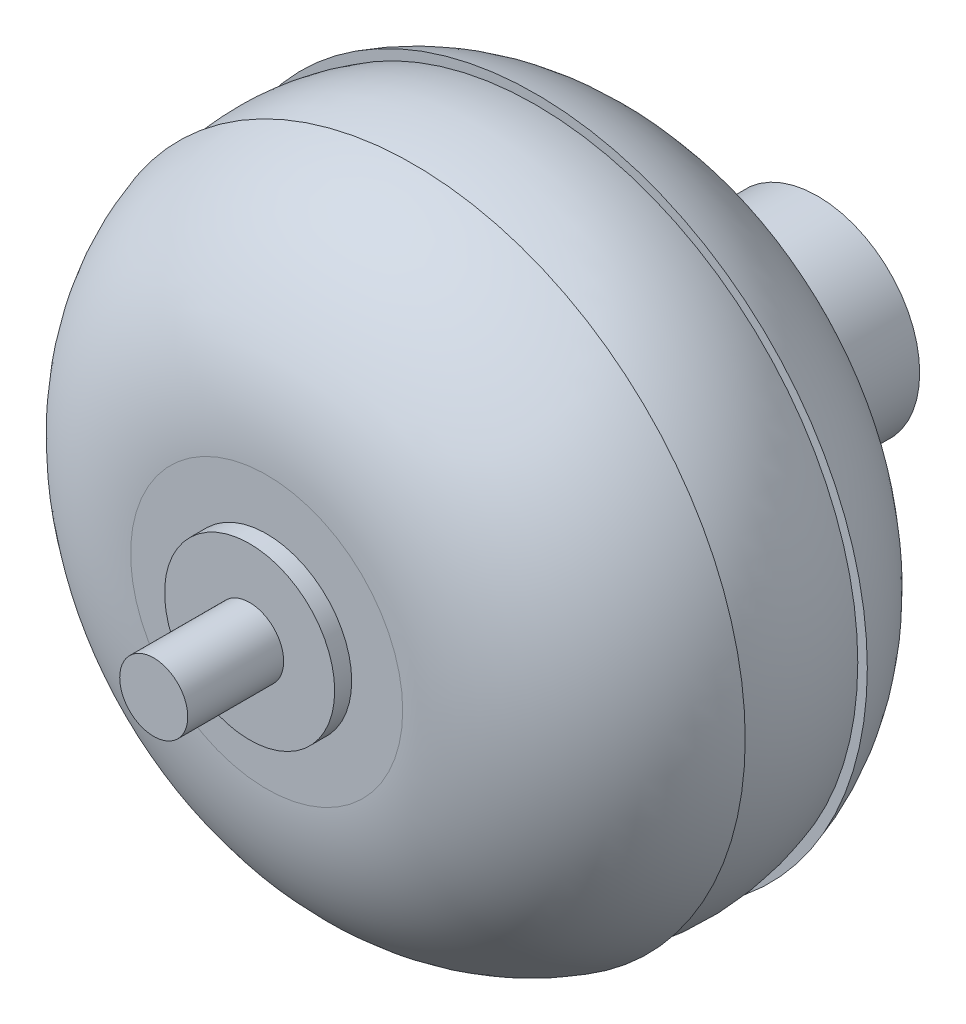
from build123d import *

# Parameters (mm, degrees)
SKETCH1_R           = 10
BOSS_EXTRUDE1_DEPTH = 12.2
SKETCH4_R           = 2.5
BOSS_EXTRUDE3_DEPTH = 0.5
SKETCH5_R           = 1
BOSS_EXTRUDE4_DEPTH = 3.32
FILLET1_R           = 6
SKETCH2_R           = 3
BOSS_EXTRUDE2_DEPTH = 4
SKETCH6_R           = 2.25
CUT_EXTRUDE1_DEPTH  = 2.55


with BuildPart() as part:
    # Sketch1 → Boss-Extrude1 (new body)
    with BuildSketch(Plane.XY):
        Circle(SKETCH1_R)
    extrude(amount=BOSS_EXTRUDE1_DEPTH)

    # Sketch4 → Boss-Extrude3 (add)
    with BuildSketch(Plane.XY.offset(12.2)):
        Circle(SKETCH4_R)
    extrude(amount=BOSS_EXTRUDE3_DEPTH)

    # Sketch5 → Boss-Extrude4 (add)
    with BuildSketch(Plane.XY.offset(12.2)):
        with Locations(Location((0, 0, 0), (0, 0, 180))):
            Circle(SKETCH5_R)
    extrude(amount=BOSS_EXTRUDE4_DEPTH)

    # Fillet1
    fillet1_edges = [part.edges().sort_by_distance(p)[0] for p in [
        (-10, 0, 0),
        (-10, 0, 12.2),
    ]]
    fillet(fillet1_edges, radius=FILLET1_R)

    # Sketch2 → Boss-Extrude2 (add)
    with BuildSketch(Plane(origin=(0, 0, 0), x_dir=(-1, 0, 0), z_dir=(0, 0, -1))):
        with Locations(Location((0, 0, 0), (0, 0, 180))):
            Circle(SKETCH2_R)
    extrude(amount=BOSS_EXTRUDE2_DEPTH)

    # Sketch6 → Cut-Extrude1 (cut)
    with BuildSketch(Plane(origin=(0, 0, -4), x_dir=(-1, 0, 0), z_dir=(0, 0, -1))):
        Circle(SKETCH6_R)
    extrude(amount=-CUT_EXTRUDE1_DEPTH, mode=Mode.SUBTRACT)

    # Sketch7 → Cut-Revolve1 (revolve, cut)
    with BuildSketch(Plane(origin=(0, 0, 0), x_dir=(0, 0, -1), z_dir=(1, 0, 0)), mode=Mode.PRIVATE) as cut_revolve1_sk:
        with BuildLine():
            Line((-7.887262955, 10.599100827), (-4.29107992, 10.599100827))
            Line((-4.29107992, 10.599100827), (-4.29107992, 9.471207056))
            ThreePointArc((-4.29107992, 9.471207056), (-6.089171437, 9.757850623), (-7.887262955, 9.471207056))
            Line((-7.887262955, 9.471207056), (-7.887262955, 10.599100827))
        make_face()
    revolve(cut_revolve1_sk.sketch.rotate(Axis((0, 0, 15.193399994), (0, 0, -1)), 90), axis=Axis((0, 0, 15.193399994), (0, 0, -1)), mode=Mode.SUBTRACT)


solid = part.part
